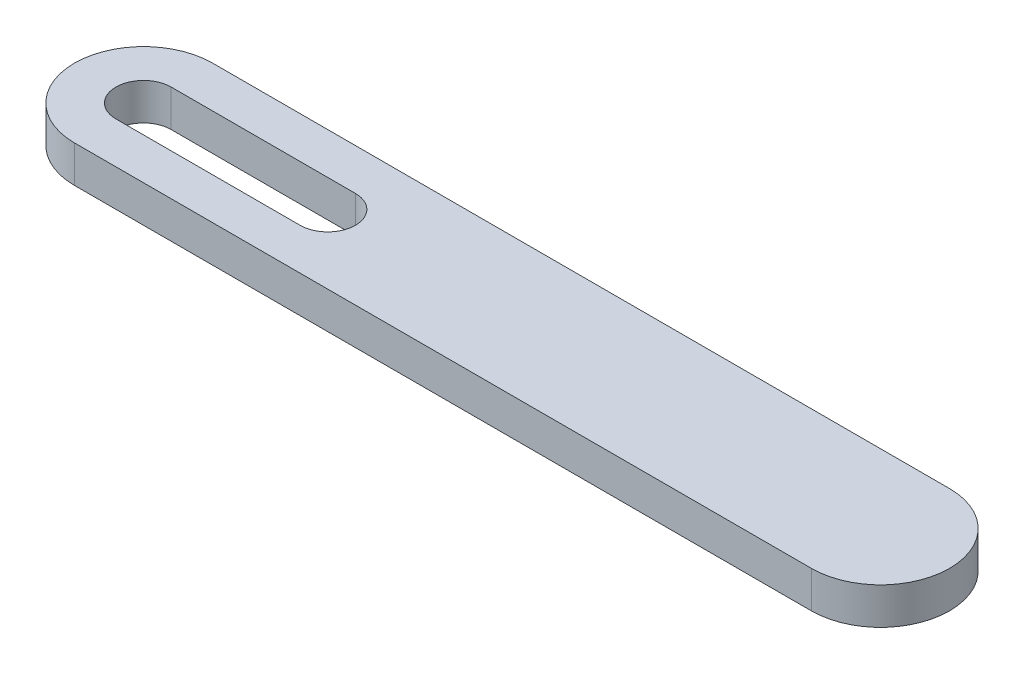
from build123d import *

# Parameters (mm, degrees)
BOSS_EXTRUDE1_DEPTH = 20


with BuildPart() as part:
    # Sketch1 → Boss-Extrude1 (new body)
    with BuildSketch(Plane(origin=(0, 0, 0), x_dir=(1, 0, 0), z_dir=(0, 1, 0))):
        with BuildLine():
            Line((0, 0), (400, 0))
            ThreePointArc((400, 0), (437.5, 37.5), (400, 75))
            Line((400, 75), (0, 75))
            ThreePointArc((0, 75), (-37.5, 37.5), (0, 0))
        make_face()
        with BuildLine():
            Line((0, 52.5), (100, 52.5))
            ThreePointArc((100, 52.5), (115, 37.5), (100, 22.5))
            Line((100, 22.5), (0, 22.5))
            ThreePointArc((0, 22.5), (-15, 37.5), (0, 52.5))
        make_face(mode=Mode.SUBTRACT)
    extrude(amount=BOSS_EXTRUDE1_DEPTH)


solid = part.part
